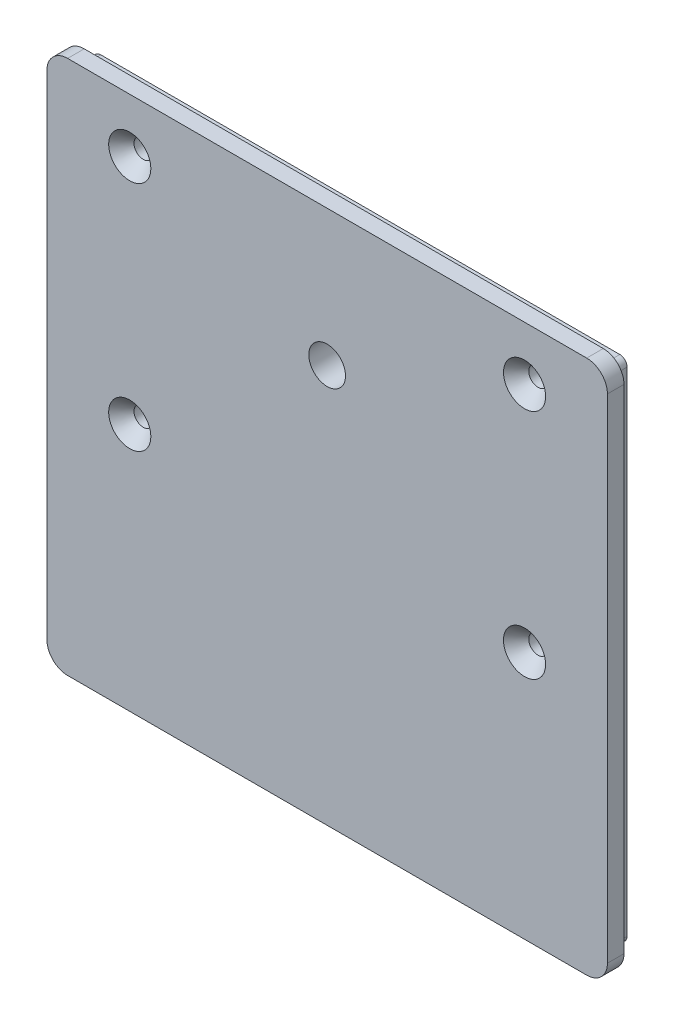
from build123d import *

# Parameters (mm, degrees)
SKETCH2_W                                      = 115.292618629
SKETCH2_H                                      = 134.000000002
BOSS_EXTRUDE2_DEPTH                            = 8
FILLET2_R                                      = 6
SKETCH19_W                                     = 8
SKETCH19_H                                     = 99
BOSS_EXTRUDE3_DEPTH                            = 115.292618629
SKETCH21_W                                     = 135.292618629
SKETCH21_H                                     = 129
SKETCH21_W_2                                   = 115.292618629
SKETCH21_H_2                                   = 99
BOSS_EXTRUDE4_DEPTH                            = 8
FILLET3_R                                      = 5
CUT_EXTRUDE1_DEPTH                             = 4
SKETCH24_W                                     = 115.292618629
SKETCH24_H                                     = 10
BOSS_EXTRUDE5_DEPTH                            = 104
FILLET4_R                                      = 6
SKETCH49_R                                     = 4.43
CUT_EXTRUDE3_DEPTH                             = 8
M2_5_CLEARANCE_HOLE1_D                         = 2.9
CUT_EXTRUDE4_START                             = -8
CUT_EXTRUDE4_DEPTH                             = 8
CHAMFER1_SIZE                                  = 0.9
CSK_FOR_8_FLAT_HEAD_MACHINE_SCREW1_D           = 4.4958
CSK_FOR_8_FLAT_HEAD_MACHINE_SCREW1_DEPTH       = 8
CSK_FOR_8_FLAT_HEAD_MACHINE_SCREW1_CSINK_D     = 10.1713792
CSK_FOR_8_FLAT_HEAD_MACHINE_SCREW1_CSINK_ANGLE = 82
CSK_FOR_8_FLAT_HEAD_MACHINE_SCREW1_TIP         = 1.350674586
SKETCH61_W                                     = 115.292618629
SKETCH61_H                                     = 134.000000002
CUT_EXTRUDE6_DEPTH                             = 65


with BuildPart() as part:
    # Sketch2 → Boss-Extrude2 (new body)
    with BuildSketch(Plane(origin=(0, 0, 0), x_dir=(1, 0, 0), z_dir=(0, 1, 0))):
        with Locations((4.853690686, 42.889279439)):
            Rectangle(SKETCH2_W, SKETCH2_H)
    extrude(amount=BOSS_EXTRUDE2_DEPTH)

    # Fillet2
    fillet2_edges = [part.edges().sort_by_distance(p)[0] for p in [
        (-52.792618629, 4, -109.88927944),
        (62.5, 4, -109.88927944),
    ]]
    fillet(fillet2_edges, radius=FILLET2_R)

    # Sketch19 → Boss-Extrude3 (add)
    with BuildSketch(Plane.ZY.offset(52.792618629)):
        with Locations((28.110720562, 13.5)):
            Rectangle(SKETCH19_W, SKETCH19_H)
    extrude(amount=-BOSS_EXTRUDE3_DEPTH)

    # Sketch21 → Boss-Extrude4 (add)
    with BuildSketch(Plane.XY.offset(32.110720562)):
        with Locations((4.853690685, 8.5)):
            Rectangle(SKETCH21_W, SKETCH21_H)
        with Locations((4.853690686, 13.5)):
            Rectangle(SKETCH21_W_2, SKETCH21_H_2, mode=Mode.SUBTRACT)
    extrude(amount=-BOSS_EXTRUDE4_DEPTH)

    # Fillet3
    fillet3_edges = [part.edges().sort_by_distance(p)[0] for p in [
        (72.5, 73, 28.110720562),
        (72.5, -56, 28.110720562),
        (-62.792618629, -56, 28.110720562),
        (-62.792618629, 73, 28.110720562),
    ]]
    fillet(fillet3_edges, radius=FILLET3_R)

    # Sketch22 → Cut-Extrude1 (cut)
    with BuildSketch(Plane(origin=(0, 0, 24.110720562), x_dir=(-1, 0, 0), z_dir=(0, 0, -1))):
        with BuildLine():
            Line((62.792618629, -51), (62.792618629, 68))
            ThreePointArc((62.792618629, 68), (61.328152535, 71.535533906), (57.792618629, 73))
            Line((57.792618629, 73), (-67.5, 73))
            ThreePointArc((-67.5, 73), (-71.035533906, 71.535533906), (-72.5, 68))
            Line((-72.5, 68), (-72.5, -51))
            ThreePointArc((-72.5, -51), (-71.035533906, -54.535533906), (-67.5, -56))
            Line((-67.5, -56), (57.792618629, -56))
            ThreePointArc((57.792618629, -56), (61.328152535, -54.535533906), (62.792618629, -51))
        make_face()
        with BuildLine():
            Line((57.792618629, 69.75), (-67.5, 69.75))
            ThreePointArc((-67.5, 69.75), (-68.737436867, 69.237436867), (-69.25, 68))
            Line((-69.25, 68), (-69.25, -51))
            ThreePointArc((-69.25, -51), (-68.737436867, -52.237436867), (-67.5, -52.75))
            Line((-67.5, -52.75), (57.792618629, -52.75))
            ThreePointArc((57.792618629, -52.75), (59.030055496, -52.237436867), (59.542618629, -51))
            Line((59.542618629, -51), (59.542618629, 68))
            ThreePointArc((59.542618629, 68), (59.030055496, 69.237436867), (57.792618629, 69.75))
        make_face(mode=Mode.SUBTRACT)
    extrude(amount=-CUT_EXTRUDE1_DEPTH, mode=Mode.SUBTRACT)

    # Sketch24 → Boss-Extrude5 (add)
    with BuildSketch(Plane(origin=(0, 0, 24.110720562), x_dir=(-1, 0, 0), z_dir=(0, 0, -1))):
        with Locations((-4.853690686, 60)):
            Rectangle(SKETCH24_W, SKETCH24_H)
    extrude(amount=BOSS_EXTRUDE5_DEPTH)

    # Fillet4
    fillet4_edges = [part.edges().sort_by_distance(p)[0] for p in [
        (62.5, 60, -79.889279438),
        (-52.792618629, 60, -79.889279438),
    ]]
    fillet(fillet4_edges, radius=FILLET4_R)

    # Sketch49 → Cut-Extrude3 (cut)
    with BuildSketch(Plane.XY.offset(32.110720562)):
        with Locations((4.853690685, 40.159632183)):
            Circle(SKETCH49_R)
    extrude(amount=-CUT_EXTRUDE3_DEPTH, mode=Mode.SUBTRACT)

    # M2.5 Clearance Hole1 (through all)
    with Locations(Plane(origin=(0, 8, 0), x_dir=(1, 0, 0), z_dir=(0, 1, 0))):
        with Locations((-28.27, 101.64), (-7.29, 101.64), (-7.29, 88.14), (-28.27, 88.14)):
            Hole(M2_5_CLEARANCE_HOLE1_D / 2)

    # Sketch60 → Cut-Extrude4 (cut)
    with BuildSketch(Plane(origin=(0, 8, 0), x_dir=(1, 0, 0), z_dir=(0, 1, 0)).offset(CUT_EXTRUDE4_START)):
        with BuildLine():
            Line((-30.27, 103.09), (-26.27, 103.09))
            ThreePointArc((-26.27, 103.09), (-24.82, 101.64), (-26.27, 100.19))
            Line((-26.27, 100.19), (-30.27, 100.19))
            ThreePointArc((-30.27, 100.19), (-31.72, 101.64), (-30.27, 103.09))
        make_face()
        with BuildLine():
            Line((-9.29, 103.09), (-5.29, 103.09))
            ThreePointArc((-5.29, 103.09), (-3.84, 101.64), (-5.29, 100.19))
            Line((-5.29, 100.19), (-9.29, 100.19))
            ThreePointArc((-9.29, 100.19), (-10.74, 101.64), (-9.29, 103.09))
        make_face()
        with BuildLine():
            Line((-30.27, 89.59), (-26.27, 89.59))
            ThreePointArc((-26.27, 89.59), (-24.82, 88.14), (-26.27, 86.69))
            Line((-26.27, 86.69), (-30.27, 86.69))
            ThreePointArc((-30.27, 86.69), (-31.72, 88.14), (-30.27, 89.59))
        make_face()
        with BuildLine():
            Line((-9.29, 89.59), (-5.29, 89.59))
            ThreePointArc((-5.29, 89.59), (-3.84, 88.14), (-5.29, 86.69))
            Line((-5.29, 86.69), (-9.29, 86.69))
            ThreePointArc((-9.29, 86.69), (-10.74, 88.14), (-9.29, 89.59))
        make_face()
    extrude(amount=CUT_EXTRUDE4_DEPTH, mode=Mode.SUBTRACT)

    # Chamfer1
    chamfer1_edges = [part.edges().sort_by_distance(p)[0] for p in [
        (-7.29, 8, -100.19),
        (-3.84, 8, -101.64),
        (-7.29, 8, -103.09),
        (-28.27, 8, -86.69),
        (-24.82, 8, -88.14),
        (-28.27, 8, -89.59),
        (-7.29, 8, -86.69),
        (-3.84, 8, -88.14),
        (-7.29, 8, -89.59),
        (-28.27, 8, -103.09),
        (-31.72, 8, -101.64),
        (-28.27, 8, -100.19),
        (-24.82, 8, -101.64),
        (-10.74, 8, -88.14),
        (-31.72, 8, -88.14),
        (-10.74, 8, -101.64),
    ]]
    chamfer(chamfer1_edges, length=CHAMFER1_SIZE)

    # CSK for #8 Flat Head Machine Screw1
    with Locations(Plane.XY.offset(32.110720562)):
        with Locations((-42.792618629, 60), (52.5, 60), (-42.792618629, 4), (52.5, 4)):
            CounterSinkHole(CSK_FOR_8_FLAT_HEAD_MACHINE_SCREW1_D / 2, CSK_FOR_8_FLAT_HEAD_MACHINE_SCREW1_CSINK_D / 2, depth=CSK_FOR_8_FLAT_HEAD_MACHINE_SCREW1_DEPTH, counter_sink_angle=CSK_FOR_8_FLAT_HEAD_MACHINE_SCREW1_CSINK_ANGLE)
            with Locations((0, 0, -(CSK_FOR_8_FLAT_HEAD_MACHINE_SCREW1_DEPTH + CSK_FOR_8_FLAT_HEAD_MACHINE_SCREW1_TIP / 2))):  # 118° drill point
                Cone(0, CSK_FOR_8_FLAT_HEAD_MACHINE_SCREW1_D / 2, CSK_FOR_8_FLAT_HEAD_MACHINE_SCREW1_TIP, mode=Mode.SUBTRACT)

    # Sketch61 → Cut-Extrude6 (cut)
    with BuildSketch(Plane(origin=(0, 65, 0), x_dir=(1, 0, 0), z_dir=(0, 1, 0))):
        with Locations((4.853690686, 42.889279439)):
            Rectangle(SKETCH61_W, SKETCH61_H)
    extrude(amount=-CUT_EXTRUDE6_DEPTH, mode=Mode.SUBTRACT)


solid = part.part
